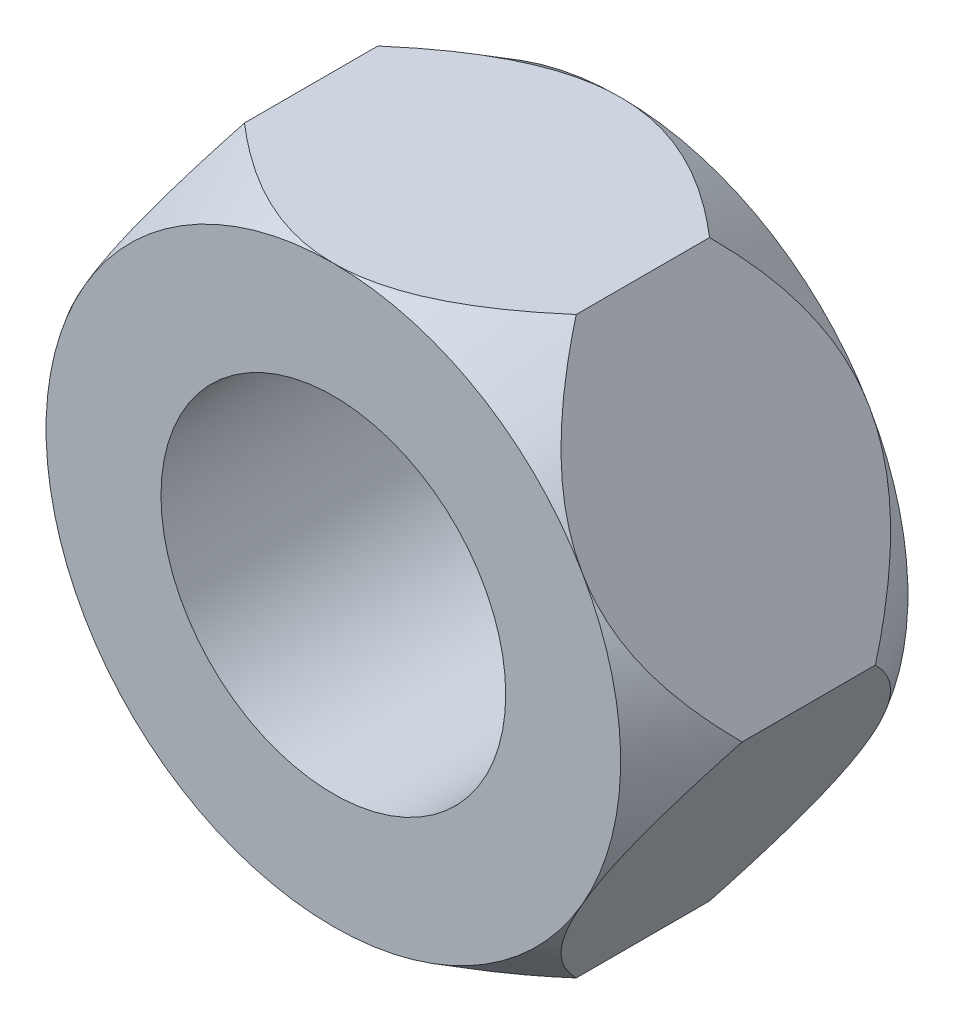
from build123d import *

# Parameters (mm, degrees)
CROQUIS1_R              = 3
SALIENTE_EXTRUIR1_DEPTH = 5
CROQUIS2_OUTSIDE_W      = 22.536
CROQUIS2_OUTSIDE_H      = 20.988
CROQUIS2_OUTSIDE_R      = 5
CORTAR_EXTRUIR1_DEPTH   = 5
CORTAR_EXTRUIR1_DRAFT   = -30
CROQUIS3_OUTSIDE_W      = 22.536
CROQUIS3_OUTSIDE_H      = 20.988
CROQUIS3_OUTSIDE_R      = 5
CORTAR_EXTRUIR2_DEPTH   = 5
CORTAR_EXTRUIR2_DRAFT   = -30


with BuildPart() as part:
    # Croquis1 → Saliente-Extruir1 (new body)
    with BuildSketch(Plane.XY):
        Polygon((5.773502692, 0), (2.886751346, 5), (-2.886751346, 5), (-5.773502692, 0), (-2.886751346, -5), (2.886751346, -5), align=None)
        Circle(CROQUIS1_R, mode=Mode.SUBTRACT)
    extrude(amount=SALIENTE_EXTRUIR1_DEPTH)


with BuildPart() as cortar_extruir1_tool:
    # Croquis2 outside → Cortar-Extruir1 (with draft: the straight prism first)
    with BuildSketch(Plane.XY.offset(5)):
        Rectangle(CROQUIS2_OUTSIDE_W, CROQUIS2_OUTSIDE_H)
        Circle(CROQUIS2_OUTSIDE_R, mode=Mode.SUBTRACT)
    extrude(amount=-CORTAR_EXTRUIR1_DEPTH)
    # Cortar-Extruir1: the draft: its side faces are tilted about the plane it starts from
    cortar_extruir1_sides = [cortar_extruir1_tool.faces().sort_by_distance(p)[0] for p in [
        (0, -10.494, 2.5),
        (11.268, 0, 2.5),
        (0, 10.494, 2.5),
        (-11.268, 0, 2.5),
        (-5, 0, 2.5),
    ]]
    draft(cortar_extruir1_sides, Plane.XY.offset(5), CORTAR_EXTRUIR1_DRAFT)


with BuildPart() as part_1:
    add(part.part)

    # Cortar-Extruir1: cut by cortar_extruir1_tool
    add(cortar_extruir1_tool.part, mode=Mode.SUBTRACT)


with BuildPart() as cortar_extruir2_tool:
    # Croquis3 outside → Cortar-Extruir2 (with draft: the straight prism first)
    with BuildSketch(Plane(origin=(0, 0, 0), x_dir=(-1, 0, 0), z_dir=(0, 0, -1))):
        Rectangle(CROQUIS3_OUTSIDE_W, CROQUIS3_OUTSIDE_H)
        Circle(CROQUIS3_OUTSIDE_R, mode=Mode.SUBTRACT)
    extrude(amount=-CORTAR_EXTRUIR2_DEPTH)
    # Cortar-Extruir2: the draft: its side faces are tilted about the plane it starts from
    cortar_extruir2_sides = [cortar_extruir2_tool.faces().sort_by_distance(p)[0] for p in [
        (0, -10.494, 2.5),
        (-11.268, 0, 2.5),
        (0, 10.494, 2.5),
        (11.268, 0, 2.5),
        (5, 0, 2.5),
    ]]
    draft(cortar_extruir2_sides, Plane(origin=(0, 0, 0), x_dir=(-1, 0, 0), z_dir=(0, 0, -1)), CORTAR_EXTRUIR2_DRAFT)


with BuildPart() as part_2:
    add(part_1.part)

    # Cortar-Extruir2: cut by cortar_extruir2_tool
    add(cortar_extruir2_tool.part, mode=Mode.SUBTRACT)


solid = part_2.part
